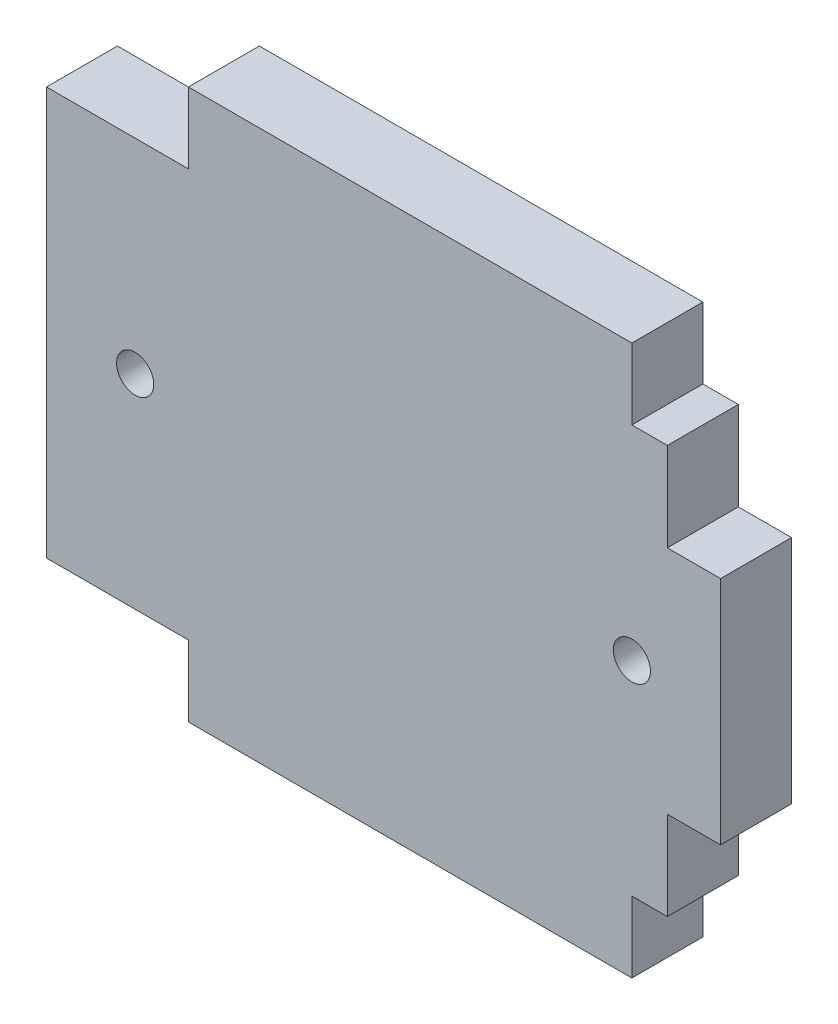
from build123d import *

# Parameters (mm, degrees)
SALIENTE_EXTRUIR1_DEPTH = 4
CORTAR_EXTRUIR1_REACH   = 55.16
CROQUIS2_R              = 1.04775


with BuildPart() as part:
    # Croquis1 → Saliente-Extruir1 (new body)
    with BuildSketch(Plane.XY):
        Polygon((-35, 0), (-35, -4), (-43, -4), (-43, -27), (-35, -27), (-35, -31), (-10, -31), (-10, -27), (-8, -27), (-8, -22), (-5, -22), (-5, -9), (-8, -9), (-8, -4), (-10, -4), (-10, 0), align=None)
    extrude(amount=SALIENTE_EXTRUIR1_DEPTH)

    # Croquis2 → Cortar-Extruir1 (cut, up to next)
    with BuildSketch(Plane.XY.offset(4), mode=Mode.PRIVATE) as cortar_extruir1_sk1:
        with Locations((-38.00175, -15.5)):
            Circle(CROQUIS2_R)
    cortar_extruir1_tool1 = extrude(cortar_extruir1_sk1.sketch, amount=-CORTAR_EXTRUIR1_REACH, mode=Mode.PRIVATE) & part.part
    # Croquis2 → Cortar-Extruir1 (cut, up to next)
    with BuildSketch(Plane.XY.offset(4), mode=Mode.PRIVATE) as cortar_extruir1_sk2:
        with Locations((-9.99825, -15.5)):
            Circle(CROQUIS2_R)
    cortar_extruir1_tool2 = extrude(cortar_extruir1_sk2.sketch, amount=-CORTAR_EXTRUIR1_REACH, mode=Mode.PRIVATE) & part.part
    add(cortar_extruir1_tool1.solids().sort_by_distance((-38.00175, -15.5, 4))[0], mode=Mode.SUBTRACT)
    add(cortar_extruir1_tool2.solids().sort_by_distance((-9.99825, -15.5, 4))[0], mode=Mode.SUBTRACT)


solid = part.part
